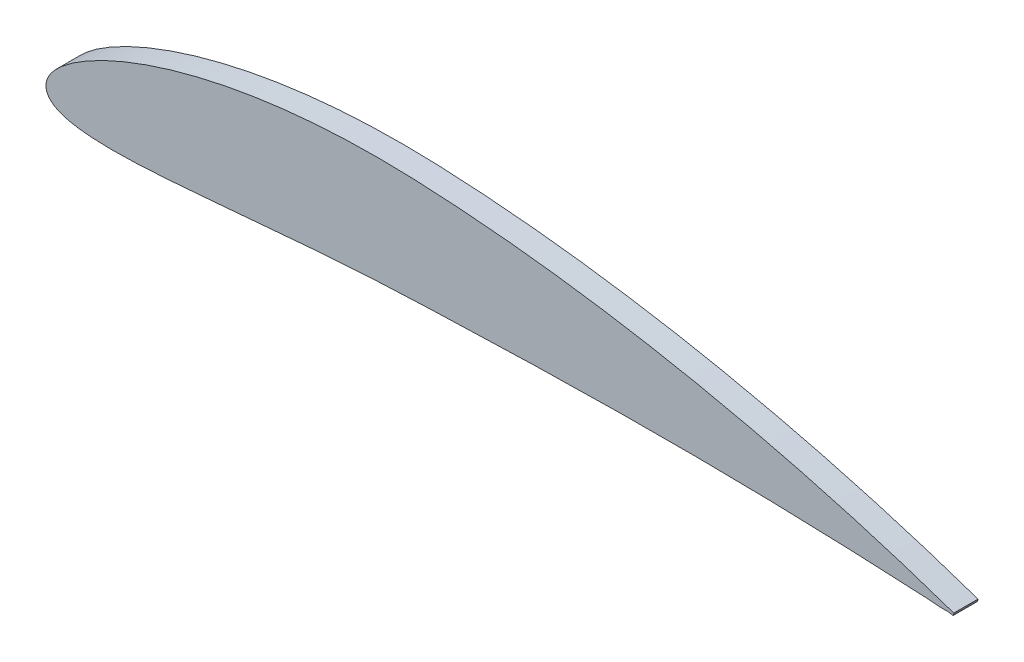
from build123d import *

# Parameters (mm, degrees)
BOSS_EXTRUDE1_DEPTH = 4


with BuildPart() as part:
    # Sketch4 → Boss-Extrude1 (new body)
    with BuildSketch(Plane.XY):
        with BuildLine():
            Line((161.891622908, 43.858716117), (161.929100397, 44.044604466))
            add(Edge.make_bspline(
                [(161.929100397, 44.044604466), (161.795678545, 44.090570928), (161.26408556, 44.273715206), (160.074141782, 44.684379157), (158.100932585, 45.346942772), (155.365289102, 46.248973127), (151.890546461, 47.353466685), (147.709173725, 48.625983179), (142.862219871, 50.026640605), (137.396269649, 51.511357346), (131.366392874, 53.035349328), (124.833179773, 54.550430689), (117.866527056, 56.018570784), (110.53916232, 57.392228166), (102.930106923, 58.630997493), (95.122906581, 59.702711047), (87.205283263, 60.57295661), (79.262177626, 61.214114685), (71.329461943, 61.635166438), (63.491952734, 61.684723238), (55.859182556, 61.301786114), (48.589529533, 60.52462408), (41.779161498, 59.399108946), (35.517702153, 57.974359093), (29.883633894, 56.319934494), (24.942812939, 54.509992034), (20.748404258, 52.61776102), (17.340127305, 50.716155562), (14.733111784, 48.872374663), (12.941331266, 47.126502105), (11.909939703, 45.473051771), (11.816442063, 43.808911915), (12.802914522, 42.475680069), (14.532273197, 41.640825649), (16.909912047, 41.092713436), (19.973132028, 40.805423124), (23.691407373, 40.747908247), (28.029144691, 40.896002128), (32.93752452, 41.213186122), (38.366140698, 41.661938446), (44.262204877, 42.190960586), (50.572585372, 42.755023336), (57.242613439, 43.305219124), (64.216908544, 43.790404795), (71.493166781, 44.156016099), (79.00660687, 44.414261901), (86.678537907, 44.680497225), (94.375484086, 44.893175452), (102.011569492, 45.047184263), (109.505352704, 45.133561595), (116.774307332, 45.148972249), (123.737407561, 45.097917318), (130.316160678, 44.992004461), (136.434686881, 44.834462643), (142.021295536, 44.652755157), (147.012142723, 44.449834839), (151.337541471, 44.256565585), (154.974326459, 44.051534679), (157.795540149, 43.95226703), (159.968219037, 43.700051338), (161.044942863, 43.856551882), (161.873607649, 43.551685856), (161.887359438, 43.786054697), (161.891622908, 43.858716117)],
                knots=[0, 0, 0, 0, 0.001371577, 0.005464776, 0.012234802, 0.021601969, 0.033461345, 0.04767125, 0.064081318, 0.082496261, 0.102719149, 0.124527079, 0.147675648, 0.171912573, 0.19697838, 0.222596912, 0.248496767, 0.274385101, 0.300041178, 0.325689988, 0.350525088, 0.374279703, 0.396711254, 0.417576734, 0.436654006, 0.45374439, 0.468679994, 0.481329415, 0.491630702, 0.499615789, 0.505546281, 0.510184984, 0.514824194, 0.520701508, 0.52851604, 0.538465752, 0.550542609, 0.564643256, 0.580638139, 0.598344876, 0.617584458, 0.638174401, 0.65992209, 0.682632113, 0.706120665, 0.730727383, 0.755700244, 0.780731769, 0.805564463, 0.829932396, 0.853570292, 0.876213105, 0.897609987, 0.917519394, 0.935698347, 0.951942678, 0.966047159, 0.97783994, 0.987174002, 0.993931501, 0.998018399, 0.999385644, 1, 1, 1, 1], degree=3))
        make_face()
    extrude(amount=BOSS_EXTRUDE1_DEPTH)


solid = part.part
